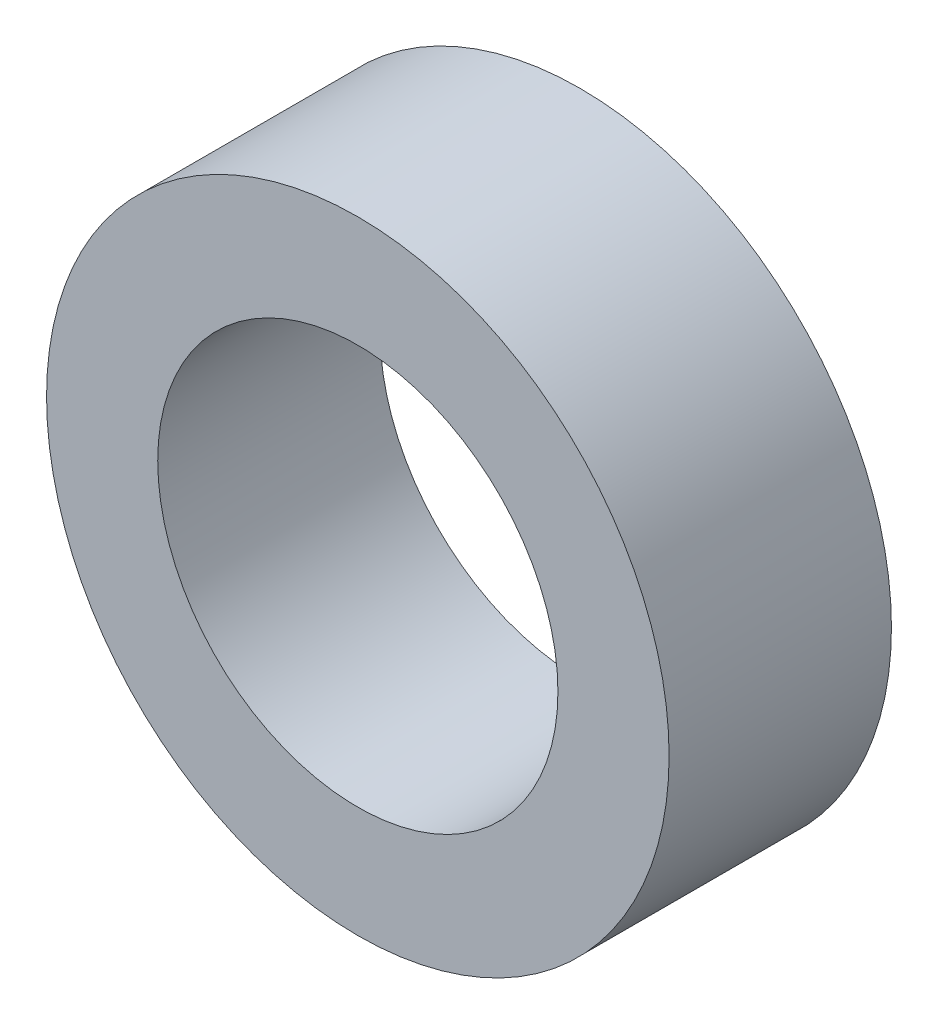
from build123d import *

# Parameters (mm, degrees)
SKETCH_1_R      = 3.5
SKETCH_1_R_2    = 2.25
EXTRUDE_1_DEPTH = 2.5


with BuildPart() as part:
    # 草图1 → 凸台-拉伸1 (new body)
    with BuildSketch(Plane.XY):
        Circle(SKETCH_1_R)
        Circle(SKETCH_1_R_2, mode=Mode.SUBTRACT)
    extrude(amount=EXTRUDE_1_DEPTH)


solid = part.part
